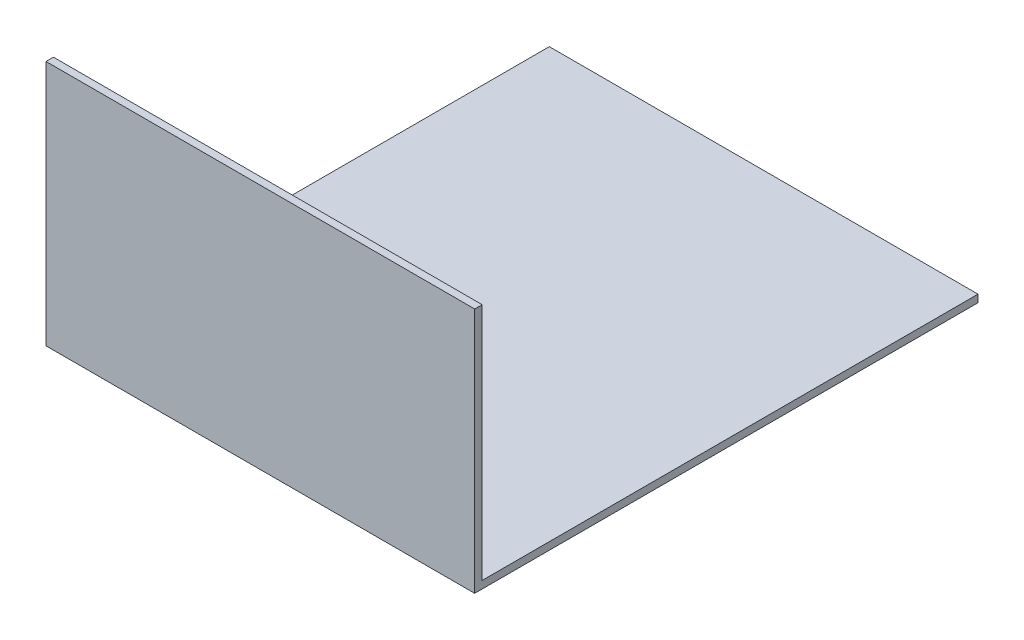
from build123d import *

# Parameters (mm, degrees)
SKETCH1_W           = 287.2
SKETCH1_H           = 337.2
BOSS_EXTRUDE1_DEPTH = 5
SKETCH2_W           = 287.2
SKETCH2_H           = 5
BOSS_EXTRUDE2_DEPTH = 160


with BuildPart() as part:
    # Sketch1 → Boss-Extrude1 (new body)
    with BuildSketch(Plane(origin=(0, 0, 0), x_dir=(1, 0, 0), z_dir=(0, 1, 0))):
        Rectangle(SKETCH1_W, SKETCH1_H)
    extrude(amount=BOSS_EXTRUDE1_DEPTH)

    # Sketch2 → Boss-Extrude2 (add)
    with BuildSketch(Plane(origin=(0, 5, 0), x_dir=(1, 0, 0), z_dir=(0, 1, 0))):
        with Locations((0, -166.1)):
            Rectangle(SKETCH2_W, SKETCH2_H)
    extrude(amount=BOSS_EXTRUDE2_DEPTH)


solid = part.part
